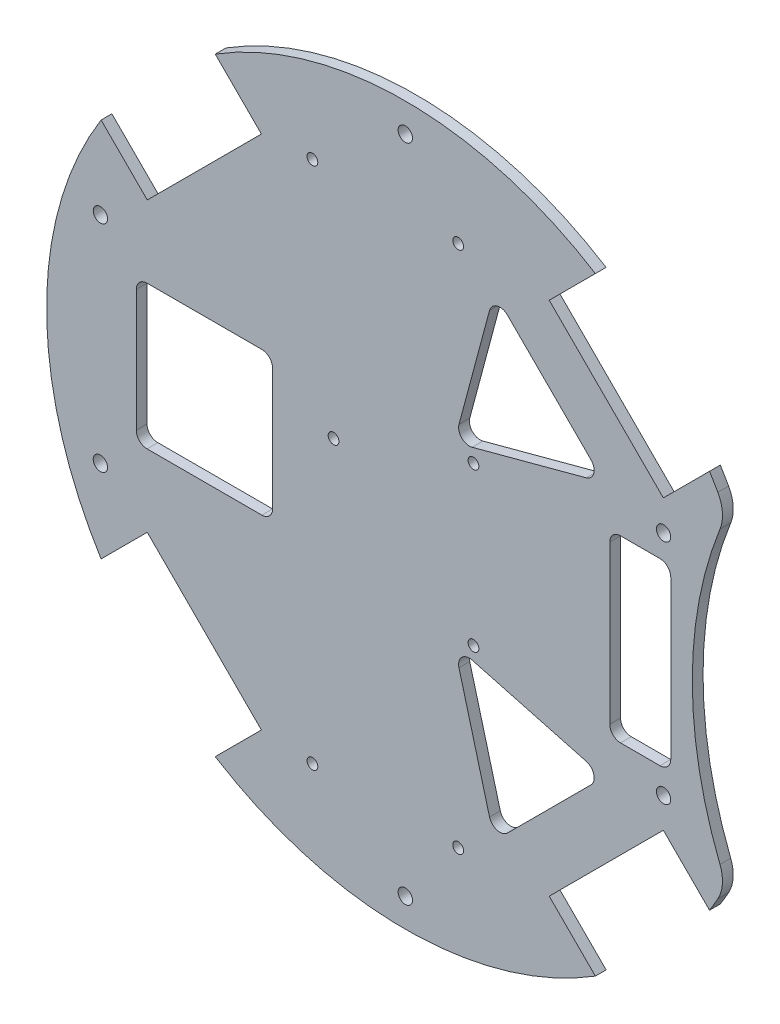
from build123d import *

# Parameters (mm, degrees)
CROQUIS1_R              = 100
SALIENTE_EXTRUIR1_DEPTH = 3
CROQUIS3_R              = 110
CORTAR_EXTRUIR1_DEPTH   = 3
REDONDEO1_R             = 10
CORTAR_EXTRUIR3_DEPTH   = 10
CROQUIS10_R             = 1.5
CORTAR_EXTRUIR4_DEPTH   = 142.453172607
CROQUIS11_R             = 2
CROQUIS11_W             = 17
CROQUIS11_H             = 50
CROQUIS11_W_2           = 38
CROQUIS11_H_2           = 40
CORTAR_EXTRUIR5_DEPTH   = 10
REDONDEO2_R             = 3
CROQUIS12_R             = 1.5
CORTAR_EXTRUIR6_DEPTH   = 142.453172607


with BuildPart() as part:
    # Croquis1 → Saliente-Extruir1 (new body)
    with BuildSketch(Plane.XY):
        Circle(CROQUIS1_R)
    extrude(amount=SALIENTE_EXTRUIR1_DEPTH)

    # Croquis3 → Cortar-Extruir1 (cut)
    with BuildSketch(Plane.XY.offset(3)):
        with Locations((190, 0)):
            Circle(CROQUIS3_R)
    extrude(amount=-CORTAR_EXTRUIR1_DEPTH, mode=Mode.SUBTRACT)

    # Redondeo1
    redondeo1_edges = [part.edges().sort_by_distance(p)[0] for p in [
        (89.473684211, -44.659375654, 1.5),
        (89.473684211, 44.659375654, 1.5),
    ]]
    fillet(redondeo1_edges, radius=REDONDEO1_R)

    # Croquis7 → Cortar-Extruir3 (cut)
    with BuildSketch(Plane.XY.offset(3)):
        Polygon((-71.939339828, -40.119534675), (-40.119534675, -71.939339828), (-57.797204204, -89.617009358), (-89.617009358, -57.797204204), align=None)
        Polygon((-40.119534675, 71.939339828), (-71.939339828, 40.119534675), (-89.617009358, 57.797204204), (-57.797204204, 89.617009358), align=None)
        Polygon((71.939339828, 40.119534675), (40.119534675, 71.939339828), (57.797204204, 89.617009358), (89.617009358, 57.797204204), align=None)
        Polygon((40.119534675, -71.939339828), (71.939339828, -40.119534675), (89.617009358, -57.797204204), (57.797204204, -89.617009358), align=None)
    extrude(amount=-CORTAR_EXTRUIR3_DEPTH, mode=Mode.SUBTRACT)

    # Croquis10 → Cortar-Extruir4 (cut, through all)
    with BuildSketch(Plane.XY.offset(3)):
        with Locations((-20, 8.5)):
            Circle(CROQUIS10_R)
        with Locations((14.74, 72.95)):
            Circle(CROQUIS10_R)
        with Locations((-25.9, 72.95)):
            Circle(CROQUIS10_R)
        with Locations(Location((14.74, -72.95, 0), (0, 0, 180))):
            Circle(CROQUIS10_R)
        with Locations(Location((-25.9, -72.95, 0), (0, 0, 180))):
            Circle(CROQUIS10_R)
    extrude(amount=-CORTAR_EXTRUIR4_DEPTH, mode=Mode.SUBTRACT)

    # Croquis11 → Cortar-Extruir5 (cut)
    with BuildSketch(Plane.XY.offset(3)):
        with Locations((0, 92)):
            Circle(CROQUIS11_R)
        with Locations((0, -92)):
            Circle(CROQUIS11_R)
        with Locations((72, 31.694913472)):
            Circle(CROQUIS11_R)
        with Locations((72, -31.694913472)):
            Circle(CROQUIS11_R)
        with Locations((-85, -30)):
            Circle(CROQUIS11_R)
        with Locations((-85, 30)):
            Circle(CROQUIS11_R)
        with Locations((65.5, 0)):
            Rectangle(CROQUIS11_W, CROQUIS11_H)
        Polygon((55.443488939, 35.561561695), (24.824867154, 66.18018348), (13.617673752, 24.354368293), align=None)
        Polygon((13.617673752, -24.354368293), (55.443488939, -35.561561695), (24.824867154, -66.18018348), align=None)
        with Locations((-56, 0)):
            Rectangle(CROQUIS11_W_2, CROQUIS11_H_2)
    extrude(amount=-CORTAR_EXTRUIR5_DEPTH, mode=Mode.SUBTRACT)

    # Redondeo2
    redondeo2_edges = [part.edges().sort_by_distance(p)[0] for p in [
        (74, 25, 1.5),
        (74, -25, 1.5),
        (57, -25, 1.5),
        (57, 25, 1.5),
        (55.443488939, 35.561561695, 1.5),
        (13.617673752, 24.354368293, 1.5),
        (24.824867154, 66.18018348, 1.5),
        (24.824867154, -66.18018348, 1.5),
        (13.617673752, -24.354368293, 1.5),
        (55.443488939, -35.561561695, 1.5),
        (-37, 20, 1.5),
        (-37, -20, 1.5),
        (-75, -20, 1.5),
        (-75, 20, 1.5),
    ]]
    fillet(redondeo2_edges, radius=REDONDEO2_R)

    # Croquis12 → Cortar-Extruir6 (cut, through all)
    with BuildSketch(Plane(origin=(0, 0, 0), x_dir=(-1, 0, 0), z_dir=(0, 0, -1))):
        with Locations((-19, 22)):
            Circle(CROQUIS12_R)
        with Locations((-19, -22)):
            Circle(CROQUIS12_R)
    extrude(amount=-CORTAR_EXTRUIR6_DEPTH, mode=Mode.SUBTRACT)


solid = part.part
